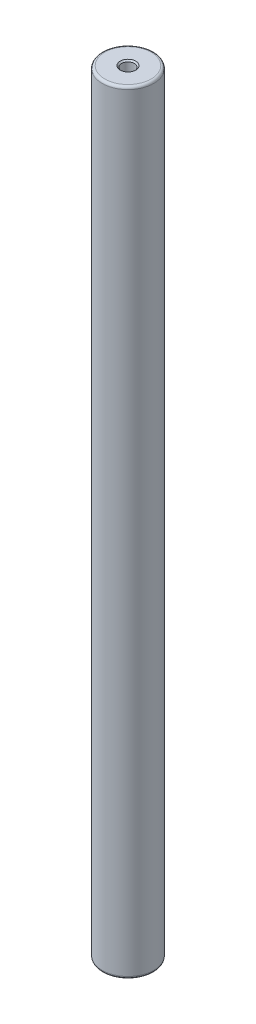
from build123d import *

# Parameters (mm, degrees)
SKETCH_1_R           = 10
EXTRUDE_1_DEPTH      = 300
M6X1_0_2_D           = 5
M6X1_0_2_DEPTH       = 15
M6X1_0_2_CSINK_D     = 6.05
M6X1_0_2_CSINK_ANGLE = 90
M6X1_0_2_TIP         = 1.502151548
FILLET_1_R           = 1
FILLET_2_R           = 1


with BuildPart() as part:
    # 草图1 → 凸台-拉伸1 (new body)
    with BuildSketch(Plane(origin=(0, 0, 0), x_dir=(1, 0, 0), z_dir=(0, 1, 0))):
        with Locations(Location((0, 0, 0), (0, 0, 270))):
            Circle(SKETCH_1_R)
    extrude(amount=EXTRUDE_1_DEPTH)

    # M6x1.0 螺纹孔2
    with Locations(Plane(origin=(0, 300, 0), x_dir=(1, 0, 0), z_dir=(0, 1, 0))):
        with Locations((0, 0)):
            CounterSinkHole(M6X1_0_2_D / 2, M6X1_0_2_CSINK_D / 2, depth=M6X1_0_2_DEPTH, counter_sink_angle=M6X1_0_2_CSINK_ANGLE)
            with Locations((0, 0, -(M6X1_0_2_DEPTH + M6X1_0_2_TIP / 2))):  # 118° drill point
                Cone(0, M6X1_0_2_D / 2, M6X1_0_2_TIP, mode=Mode.SUBTRACT)

    # 圆角1
    fillet_1_edges = [part.edges().sort_by_distance(p)[0] for p in [
        (0, 300, -10),
    ]]
    fillet(fillet_1_edges, radius=FILLET_1_R)

    # 圆角2
    fillet_2_edges = [part.edges().sort_by_distance(p)[0] for p in [
        (0, 0, -10),
    ]]
    fillet(fillet_2_edges, radius=FILLET_2_R)


solid = part.part
